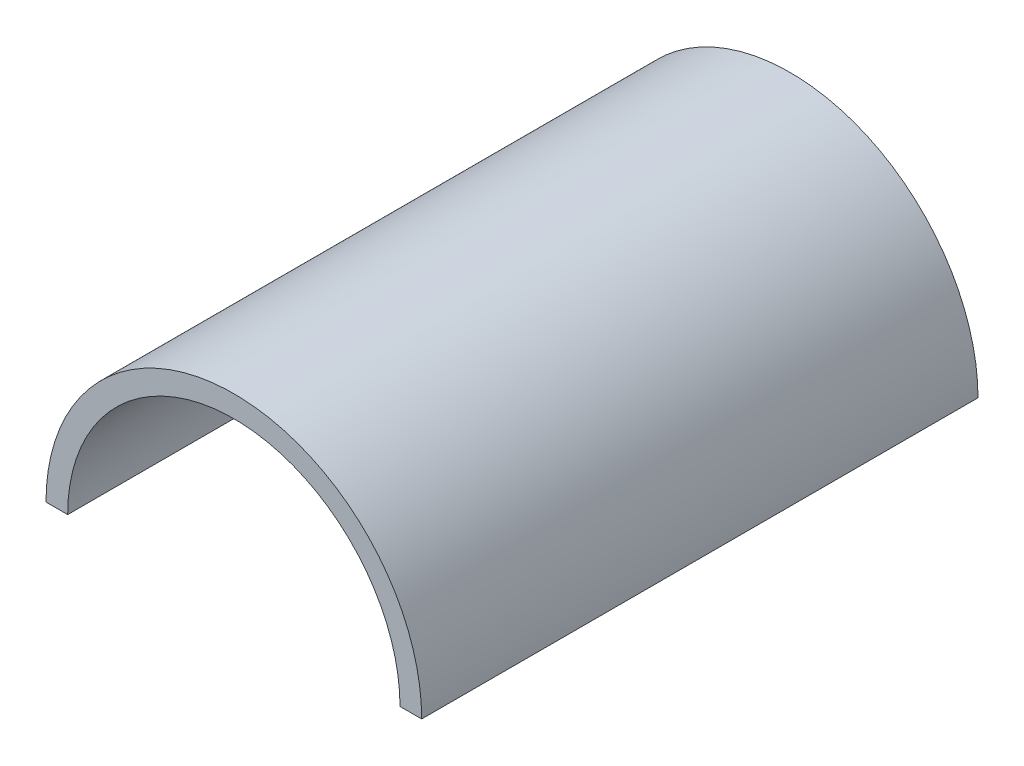
from build123d import *

# Parameters (mm, degrees)
BOSS_EXTRUDE1_DEPTH = 77


with BuildPart() as part:
    # Sketch1 → Boss-Extrude1 (new body)
    with BuildSketch(Plane.XY):
        with BuildLine():
            Line((-23, 0), (-26, 0))
            ThreePointArc((-26, 0), (0, 26), (26, 0))
            Line((26, 0), (23, 0))
            ThreePointArc((23, 0), (0, 23), (-23, 0))
        make_face()
    extrude(amount=BOSS_EXTRUDE1_DEPTH)


solid = part.part
